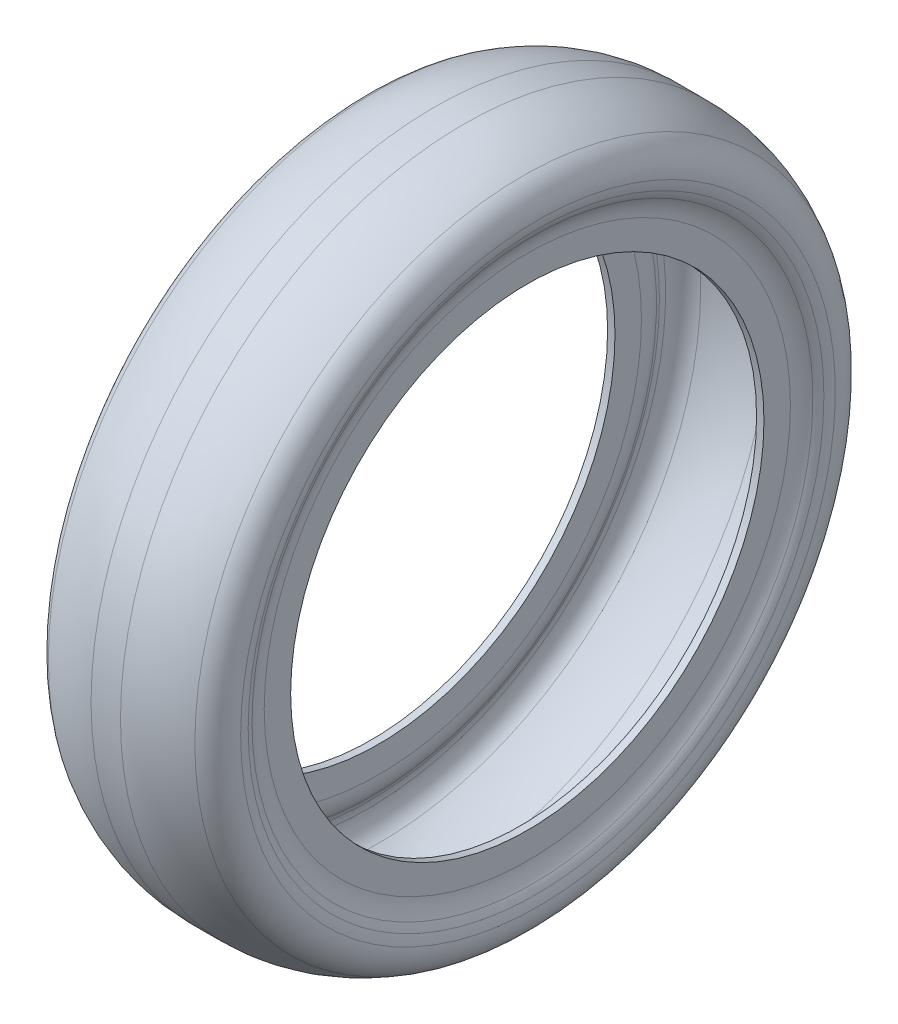
from build123d import *


with BuildPart() as part:
    # Esquisse1 → Base-Révol.-Mince (revolve)
    with BuildSketch(Plane.XY, mode=Mode.PRIVATE) as base_r_vol_mince_sk:
        with BuildLine():
            Line((47.14, 224), (47.14, 249.049268796))
            ThreePointArc((47.14, 249.049268796), (45.892888665, 257.609139906), (42.255240439, 265.457336864))
            ThreePointArc((42.255240439, 265.457336864), (40.340995096, 268.849764401), (38.882433843, 272.461619727))
            ThreePointArc((38.882433843, 272.461619727), (37.696895241, 276.891835415), (37.026248707, 281.428634513))
            ThreePointArc((37.026248707, 281.428634513), (40.251283732, 297.873165041), (51.793419901, 310.022343114))
            ThreePointArc((51.793419901, 310.022343114), (78.506393747, 321.189589279), (107.207807105, 325))
            Line((107.207807105, 325), (135.072192895, 325))
            ThreePointArc((135.072192895, 325), (163.773606253, 321.189589279), (190.486580099, 310.022343114))
            ThreePointArc((190.486580099, 310.022343114), (202.028716268, 297.873165041), (205.253751293, 281.428634513))
            ThreePointArc((205.253751293, 281.428634513), (204.583104759, 276.891835415), (203.397566157, 272.461619727))
            ThreePointArc((203.397566157, 272.461619727), (201.939004904, 268.849764401), (200.024759561, 265.457336864))
            ThreePointArc((200.024759561, 265.457336864), (196.387111335, 257.609139906), (195.14, 249.049268796))
            Line((195.14, 249.049268796), (195.14, 224))
            Line((195.14, 224), (188.14, 224))
            Line((188.14, 224), (188.14, 249.049268796))
            ThreePointArc((188.14, 249.049268796), (189.67810398, 259.606443165), (194.164536793, 269.28588608))
            ThreePointArc((194.164536793, 269.28588608), (195.632124888, 271.886747191), (196.750355182, 274.655836275))
            ThreePointArc((196.750355182, 274.655836275), (197.728424529, 278.310764218), (198.281707919, 282.053623473))
            ThreePointArc((198.281707919, 282.053623473), (195.809181067, 294.661096878), (186.960210004, 303.975466734))
            ThreePointArc((186.960210004, 303.975466734), (161.947152676, 314.432069961), (135.072192895, 318))
            Line((135.072192895, 318), (107.207807105, 318))
            ThreePointArc((107.207807105, 318), (80.332847324, 314.432069961), (55.319789996, 303.975466734))
            ThreePointArc((55.319789996, 303.975466734), (46.470818933, 294.661096878), (43.998292081, 282.053623473))
            ThreePointArc((43.998292081, 282.053623473), (44.551575471, 278.310764218), (45.529644818, 274.655836275))
            ThreePointArc((45.529644818, 274.655836275), (46.647875112, 271.886747191), (48.115463207, 269.28588608))
            ThreePointArc((48.115463207, 269.28588608), (52.60189602, 259.606443165), (54.14, 249.049268796))
            Line((54.14, 249.049268796), (54.14, 224))
            Line((54.14, 224), (47.14, 224))
        make_face()
    revolve(base_r_vol_mince_sk.sketch.rotate(Axis((130.136206897, 0, 0), (1, 0, 0)), 90), axis=Axis((130.136206897, 0, 0), (1, 0, 0)))


solid = part.part
